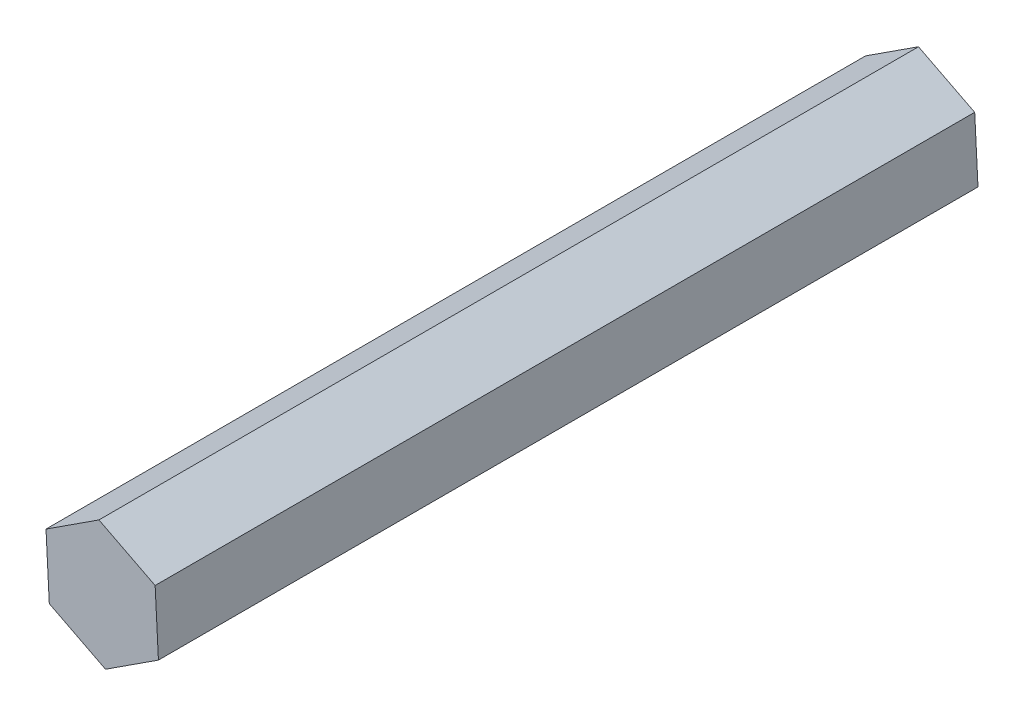
from build123d import *

# Parameters (mm, degrees)
BOSS_EXTRUDE2_DEPTH = 95.25


with BuildPart() as part:
    # Sketch2 → Boss-Extrude2 (new body)
    with BuildSketch(Plane.XY):
        Polygon((-6.532932597, 3.329282958), (-6.149709917, -3.993044111), (0.38322268, -7.322327069), (6.532932597, -3.329282958), (6.149709917, 3.993044111), (-0.38322268, 7.322327069), align=None)
    extrude(amount=BOSS_EXTRUDE2_DEPTH)


solid = part.part
